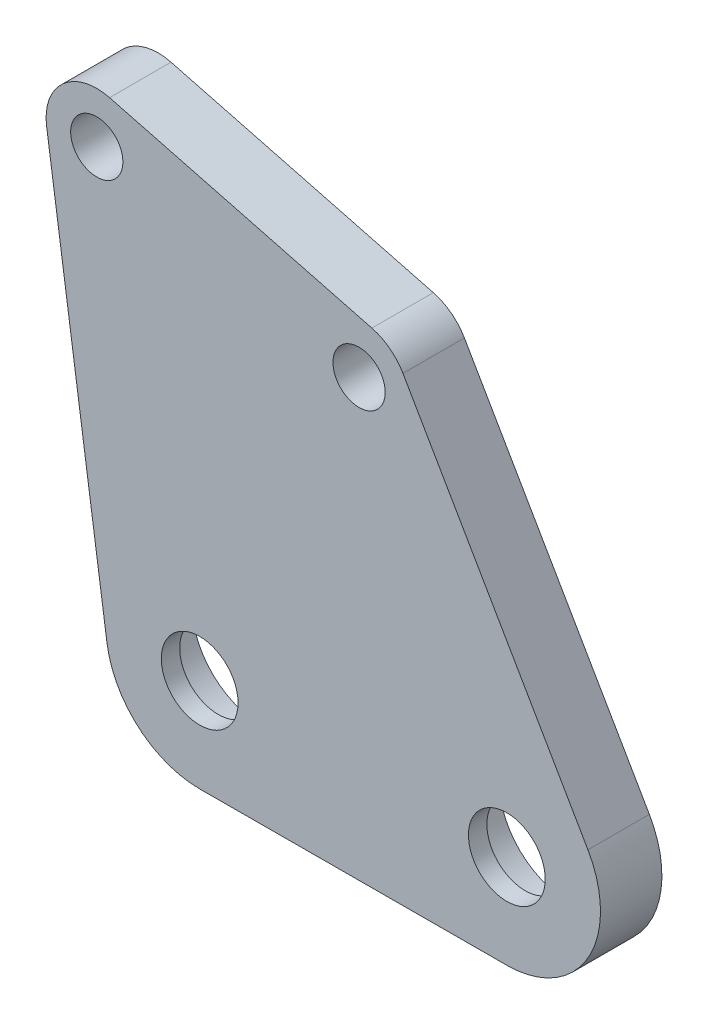
from build123d import *

# Parameters (mm, degrees)
SKETCH1_R           = 8.25
SKETCH1_R_2         = 4.25
SKETCH1_R_3         = 15.25
SKETCH1_R_4         = 11.25
SKETCH1_R_5         = 6.25
BOSS_EXTRUDE2_DEPTH = 10
SKETCH1_5_R         = 11.25
CUT_EXTRUDE5_DEPTH  = 7


with BuildPart() as part:
    # Sketch1 → Boss-Extrude2 (new body)
    # profile 1 of 7: a face of its own
    with BuildSketch(Plane.XY):
        with BuildLine():
            Line((64.758616135, -27.860720154), (22.059293714, -16.720850027))
            ThreePointArc((22.059293714, -16.720850027), (26.505216378, -19.659807339), (28.226652646, -24.703650675))
            ThreePointArc((28.226652646, -24.703650675), (20.56881743, -32.932371163), (11.81166092, -25.884925461))
            Line((11.81166092, -25.884925461), (21.633984529, -93.776995906))
            ThreePointArc((21.633984529, -93.776995906), (35.63224039, -76.382762218), (51.976848021, -91.593427362))
            ThreePointArc((51.976848021, -91.593427362), (47.525288564, -102.361722577), (36.769479911, -106.843367773))
            Line((36.769479911, -106.843367773), (86.769284535, -106.703591085))
            ThreePointArc((86.769284535, -106.703591085), (73.507639588, -83.849691589), (99.930570224, -83.823509091))
            Line((99.930570224, -83.823509091), (69.819078019, -31.715739289))
            ThreePointArc((69.819078019, -31.715739289), (70.644447296, -33.706712359), (70.925975067, -35.843520802))
            ThreePointArc((70.925975067, -35.843520802), (56.147411334, -40.887364137), (64.758616135, -27.860720154))
        make_face()
    # profile 2 of 7: a face of its own
    with BuildSketch(Plane.XY):
        with Locations((62.675975067, -35.843520802)):
            Circle(SKETCH1_R)
        with Locations((62.675975067, -35.843520802)):
            Circle(SKETCH1_R_2, mode=Mode.SUBTRACT)
    # profile 3 of 7: a face of its own
    with BuildSketch(Plane.XY):
        with Locations((36.726848021, -91.593427362)):
            Circle(SKETCH1_R_3)
        with Locations((36.726848021, -91.593427362)):
            Circle(SKETCH1_R_4, mode=Mode.SUBTRACT)
    # profile 4 of 7: a face of its own
    with BuildSketch(Plane.XY):
        with Locations((86.726652646, -91.453650675)):
            Circle(SKETCH1_R_3)
        with Locations((86.726652646, -91.453650675)):
            Circle(SKETCH1_R_4, mode=Mode.SUBTRACT)
    # profile 5 of 7: a face of its own
    with BuildSketch(Plane.XY):
        with Locations((19.976652646, -24.703650675)):
            Circle(SKETCH1_R)
        with Locations((19.976652646, -24.703650675)):
            Circle(SKETCH1_R_2, mode=Mode.SUBTRACT)
    # profile 6 of 7: a face of its own
    with BuildSketch(Plane.XY):
        with Locations((36.726848021, -91.593427362)):
            Circle(SKETCH1_R_4)
        with Locations((36.726848021, -91.593427362)):
            Circle(SKETCH1_R_5, mode=Mode.SUBTRACT)
    # profile 7 of 7: a face of its own
    with BuildSketch(Plane.XY):
        with Locations((86.726652646, -91.453650675)):
            Circle(SKETCH1_R_4)
        with Locations((86.726652646, -91.453650675)):
            Circle(SKETCH1_R_5, mode=Mode.SUBTRACT)
    extrude(amount=BOSS_EXTRUDE2_DEPTH)

    # Sketch1<5> → Cut-Extrude5 (cut)
    with BuildSketch(Plane.XY):
        with Locations((86.726652646, -91.453650675)):
            Circle(SKETCH1_5_R)
        with Locations((36.726848021, -91.593427362)):
            Circle(SKETCH1_5_R)
    extrude(amount=CUT_EXTRUDE5_DEPTH, mode=Mode.SUBTRACT)


solid = part.part
